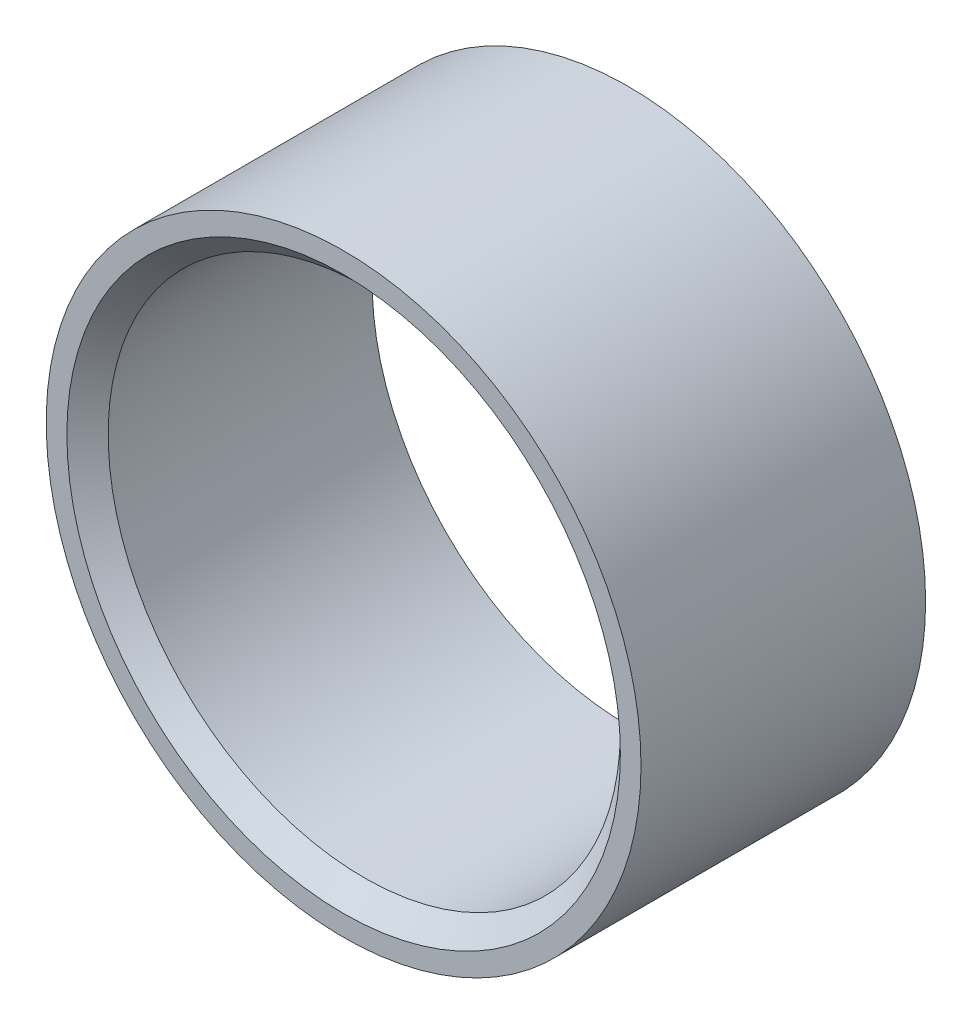
from build123d import *

# Parameters (mm, degrees)
SKETCH2_R           = 18.288
SKETCH2_R_2         = 15.748
BOSS_EXTRUDE1_DEPTH = 17.5006
CHAMFER1_SIZE       = 1.27


with BuildPart() as part:
    # Sketch2 → Boss-Extrude1 (new body)
    with BuildSketch(Plane.XY):
        Circle(SKETCH2_R)
        Circle(SKETCH2_R_2, mode=Mode.SUBTRACT)
    extrude(amount=BOSS_EXTRUDE1_DEPTH)

    # Chamfer1
    chamfer1_edges = [part.edges().sort_by_distance(p)[0] for p in [
        (-15.748, 0, 17.5006),
    ]]
    chamfer(chamfer1_edges, length=CHAMFER1_SIZE)


solid = part.part
